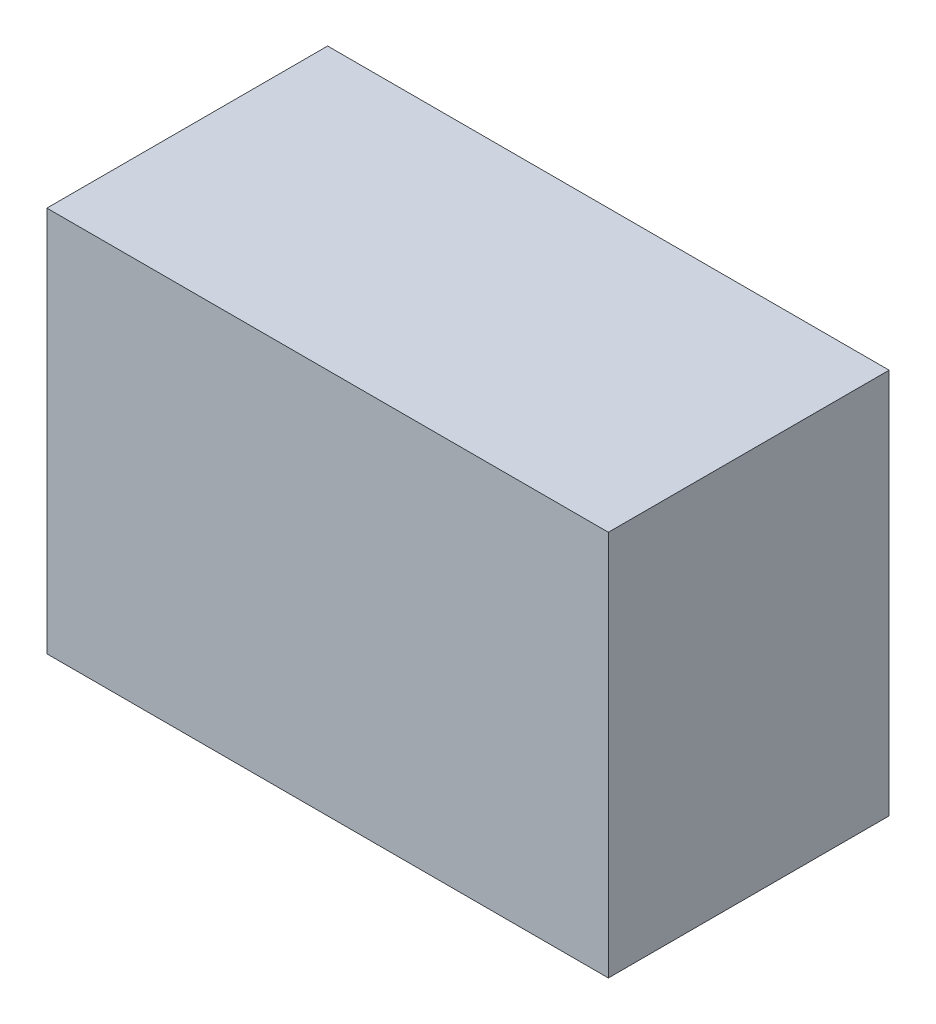
from build123d import *

# Parameters (mm, degrees)
SKETCH1_W           = 16
SKETCH1_H           = 11
BOSS_EXTRUDE1_DEPTH = 8


with BuildPart() as part:
    # Sketch1 → Boss-Extrude1 (new body)
    with BuildSketch(Plane.XY):
        with Locations((-8, 5.5)):
            Rectangle(SKETCH1_W, SKETCH1_H)
    extrude(amount=BOSS_EXTRUDE1_DEPTH)


solid = part.part
